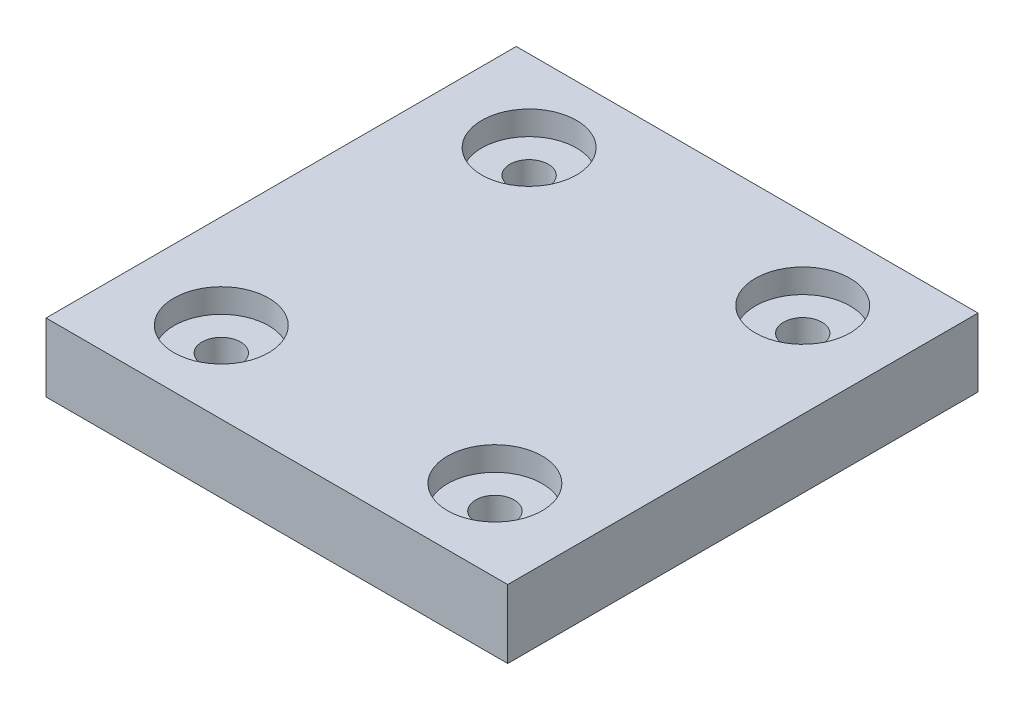
from build123d import *

# Parameters (mm, degrees)
SKETCH1_W                                    = 54
SKETCH1_H                                    = 55
BOSS_EXTRUDE1_DEPTH                          = 8
CBORE_FOR_M4_HEX_HEAD_CAP_SCREW1_D           = 4.5
CBORE_FOR_M4_HEX_HEAD_CAP_SCREW1_CBORE_D     = 11.083
CBORE_FOR_M4_HEX_HEAD_CAP_SCREW1_CBORE_DEPTH = 2.8


with BuildPart() as part:
    # Sketch1 → Boss-Extrude1 (new body)
    with BuildSketch(Plane(origin=(0, 0, 0), x_dir=(1, 0, 0), z_dir=(0, 1, 0))):
        Rectangle(SKETCH1_W, SKETCH1_H)
    extrude(amount=BOSS_EXTRUDE1_DEPTH)

    # CBORE for M4 Hex Head Cap Screw1 (through all)
    with Locations(Plane(origin=(0, 8, 0), x_dir=(1, 0, 0), z_dir=(0, 1, 0))):
        with Locations((-16, 18), (16, 18), (16, -18), (-16, -18)):
            CounterBoreHole(CBORE_FOR_M4_HEX_HEAD_CAP_SCREW1_D / 2, CBORE_FOR_M4_HEX_HEAD_CAP_SCREW1_CBORE_D / 2, CBORE_FOR_M4_HEX_HEAD_CAP_SCREW1_CBORE_DEPTH)


solid = part.part
